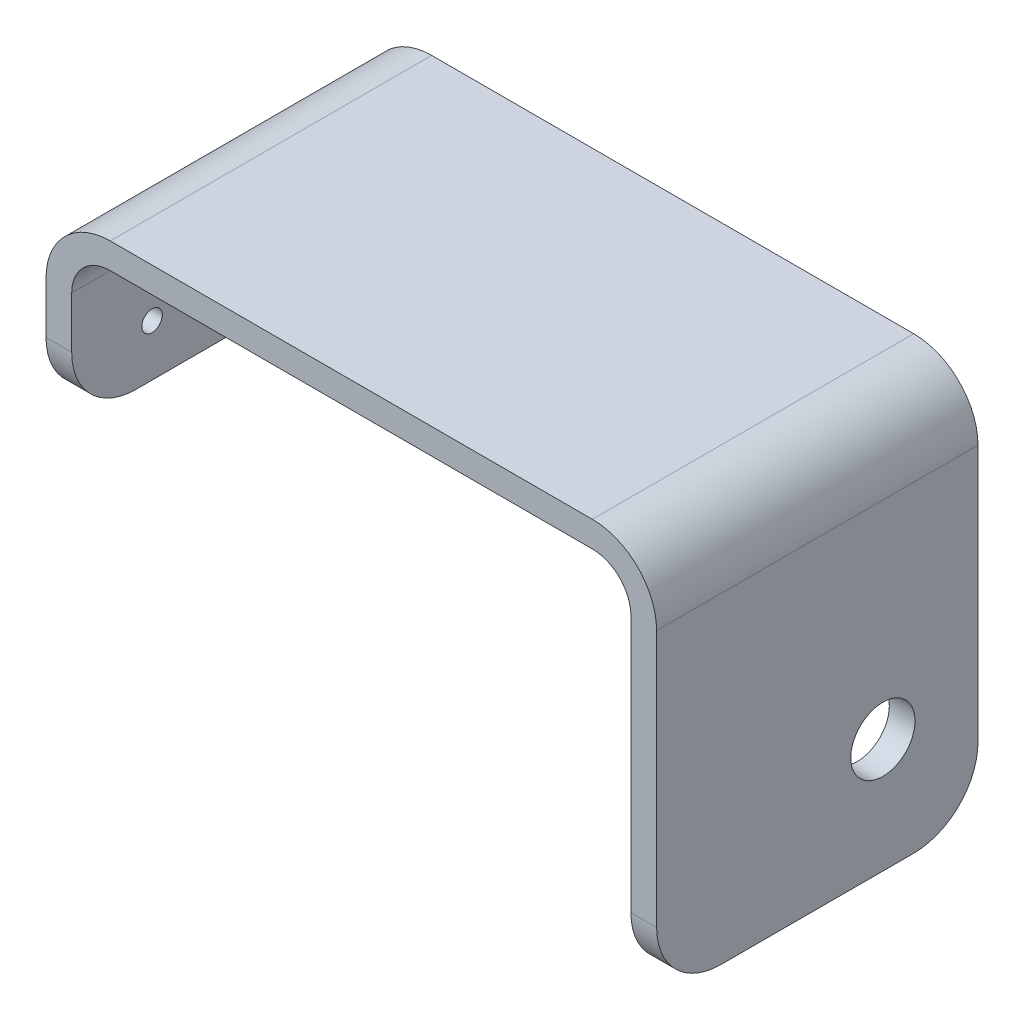
from build123d import *

# Parameters (mm, degrees)
BOSS_EXTRUDE1_DEPTH = 50
SKETCH3_R           = 1.6
CUT_EXTRUDE1_DEPTH  = 50
SKETCH4_R           = 5
CUT_EXTRUDE2_DEPTH  = 50
FILLET1_R           = 10
FILLET2_R           = 6
FILLET3_R           = 10


with BuildPart() as part:
    # Sketch2 → Boss-Extrude1 (new body)
    with BuildSketch(Plane.XY):
        Polygon((0, 0), (-95, 0), (-95, -28), (-91, -28), (-91, -4), (-4, -4), (-4, -60), (0, -60), align=None)
    extrude(amount=BOSS_EXTRUDE1_DEPTH)

    # Sketch3 → Cut-Extrude1 (cut)
    with BuildSketch(Plane.ZY.offset(95)):
        with Locations((12.5, -20)):
            Circle(SKETCH3_R)
        with Locations((37.5, -20)):
            Circle(SKETCH3_R)
    extrude(amount=-CUT_EXTRUDE1_DEPTH, mode=Mode.SUBTRACT)

    # Sketch4 → Cut-Extrude2 (cut)
    with BuildSketch(Plane(origin=(0, 0, 0), x_dir=(0, 0, -1), z_dir=(1, 0, 0))):
        with Locations((-14.8, -42.25)):
            Circle(SKETCH4_R)
    extrude(amount=-CUT_EXTRUDE2_DEPTH, mode=Mode.SUBTRACT)

    # Fillet1
    fillet1_edges = [part.edges().sort_by_distance(p)[0] for p in [
        (-95, 0, 25),
        (0, 0, 25),
    ]]
    fillet(fillet1_edges, radius=FILLET1_R)

    # Fillet2
    fillet2_edges = [part.edges().sort_by_distance(p)[0] for p in [
        (-4, -4, 25),
        (-91, -4, 25),
    ]]
    fillet(fillet2_edges, radius=FILLET2_R)

    # Fillet3
    fillet3_edges = [part.edges().sort_by_distance(p)[0] for p in [
        (-93, -28, 0),
        (-93, -28, 50),
        (-2, -60, 50),
        (-2, -60, 0),
    ]]
    fillet(fillet3_edges, radius=FILLET3_R)


solid = part.part
